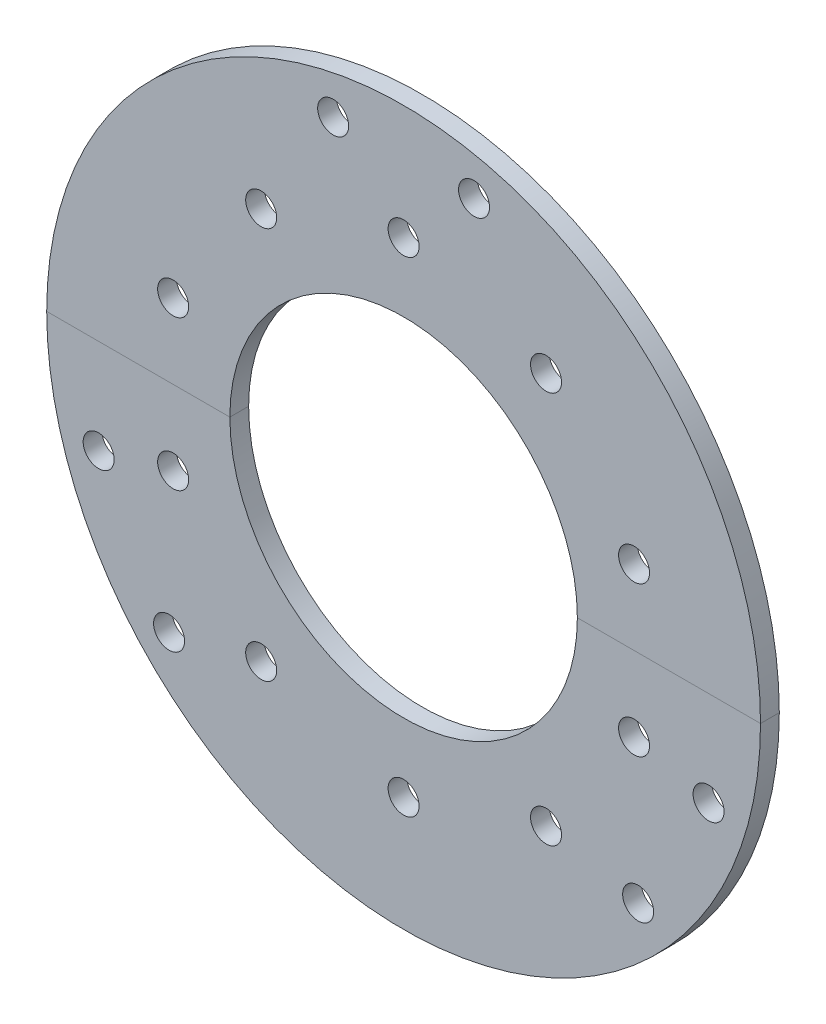
from build123d import *

# Parameters (mm, degrees)
SKETCH1_R           = 76
SKETCH1_R_2         = 37
SKETCH1_R_3         = 3.3
BOSS_EXTRUDE1_DEPTH = 4


with BuildPart() as part:
    # Sketch1 → Boss-Extrude1 (new body)
    with BuildSketch(Plane.XY):
        Circle(SKETCH1_R)
        Circle(SKETCH1_R_2, mode=Mode.SUBTRACT)
        with Locations((0, 51.6)):
            Circle(SKETCH1_R_3, mode=Mode.SUBTRACT)
        with Locations((30.329719018, 41.74527691)):
            Circle(SKETCH1_R_3, mode=Mode.SUBTRACT)
        with Locations((49.074516241, 15.94527691)):
            Circle(SKETCH1_R_3, mode=Mode.SUBTRACT)
        with Locations((49.074516241, -15.94527691)):
            Circle(SKETCH1_R_3, mode=Mode.SUBTRACT)
        with Locations((30.329719018, -41.74527691)):
            Circle(SKETCH1_R_3, mode=Mode.SUBTRACT)
        with Locations((0, -51.6)):
            Circle(SKETCH1_R_3, mode=Mode.SUBTRACT)
        with Locations((-30.329719018, -41.74527691)):
            Circle(SKETCH1_R_3, mode=Mode.SUBTRACT)
        with Locations((-49.074516241, -15.94527691)):
            Circle(SKETCH1_R_3, mode=Mode.SUBTRACT)
        with Locations((-49.074516241, 15.94527691)):
            Circle(SKETCH1_R_3, mode=Mode.SUBTRACT)
        with Locations((-30.329719018, 41.74527691)):
            Circle(SKETCH1_R_3, mode=Mode.SUBTRACT)
        with Locations((-15, 66.324957595)):
            Circle(SKETCH1_R_3, mode=Mode.SUBTRACT)
        with Locations((15, 66.324957595)):
            Circle(SKETCH1_R_3, mode=Mode.SUBTRACT)
        with Locations((64.939098182, -20.172097741)):
            Circle(SKETCH1_R_3, mode=Mode.SUBTRACT)
        with Locations((49.939098182, -46.152859854)):
            Circle(SKETCH1_R_3, mode=Mode.SUBTRACT)
        with Locations((-49.939098182, -46.152859854)):
            Circle(SKETCH1_R_3, mode=Mode.SUBTRACT)
        with Locations((-64.939098182, -20.172097741)):
            Circle(SKETCH1_R_3, mode=Mode.SUBTRACT)
    extrude(amount=BOSS_EXTRUDE1_DEPTH)


with BuildPart() as body_2:
    # Split1: the piece on the far side of the plane
    add(part.part)
    split(bisect_by=Plane.ZX, keep=Keep.BOTTOM)


with BuildPart() as part_1:
    add(part.part)

    # Split1
    split(bisect_by=Plane.ZX, keep=Keep.TOP)


solid = Compound([body_2.part, part_1.part])
